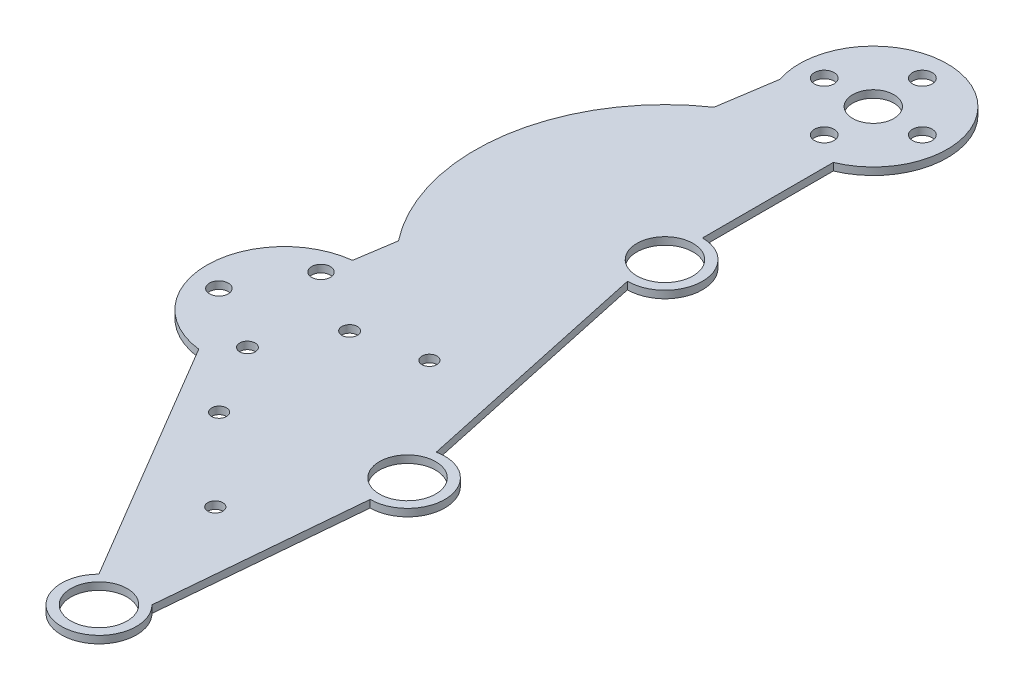
from build123d import *

# Parameters (mm, degrees)
SKETCH1_R           = 1.6
SKETCH1_R_2         = 2
SKETCH1_R_3         = 1.65
SKETCH1_R_4         = 6
BOSS_EXTRUDE2_DEPTH = 1.5875
BOSS_EXTRUDE3_START = -1.5875
BOSS_EXTRUDE3_DEPTH = 1.5875
SKETCH4_R           = 4.4
SKETCH4_R_2         = 2.1
CUT_EXTRUDE1_DEPTH  = 1.5875


with BuildPart() as part:
    # Sketch1 → Boss-Extrude2 (new body)
    with BuildSketch(Plane(origin=(0, 0, 0), x_dir=(1, 0, 0), z_dir=(0, 1, 0))):
        with BuildLine():
            Line((57.785577921, -3.804263015), (46.607089569, 48.169037391))
            ThreePointArc((46.607089569, 48.169037391), (54.607089569, 56.169037391), (46.607089569, 64.169037391))
            Line((46.607089569, 64.169037391), (46.607089569, 96.669037391))
            ThreePointArc((46.607089569, 96.669037391), (9.774896481, 73.010639225), (15.974342375, 29.675928865))
            Line((15.974342375, 29.675928865), (13.412399058, 22.705365919))
            ThreePointArc((13.412399058, 22.705365919), (-1.253243965, 6.307648563), (13.412399058, -10.090068793))
            Line((13.412399058, -10.090068793), (44.33382846, -62.316035804))
            ThreePointArc((44.33382846, -62.316035804), (50, -75.963557391), (55.66617154, -62.316035804))
            Line((55.66617154, -62.316035804), (59.462816555, -19.578912916))
            ThreePointArc((59.462816555, -19.578912916), (67.394599283, -10.759075533), (57.785577921, -3.804263015))
        make_face()
        with Locations(Location((27.233234802, -19.578912916, 0), (0, 0, 270))):
            Circle(SKETCH1_R, mode=Mode.SUBTRACT)
        with Locations(Location((44.33382846, -37.488387538, 0), (0, 0, 270))):
            Circle(SKETCH1_R, mode=Mode.SUBTRACT)
        with Locations(Location((40.089632361, 12.439739227, 0), (0, 0, 270))):
            Circle(SKETCH1_R, mode=Mode.SUBTRACT)
        with Locations(Location((12.19812376, 17.202869591, 0), (0, 0, 270))):
            Circle(SKETCH1_R_2, mode=Mode.SUBTRACT)
        with Locations(Location((26.141977063, 9.356280839, 0), (0, 0, 270))):
            Circle(SKETCH1_R_3, mode=Mode.SUBTRACT)
        with Locations(Location((4.351535007, 3.259016288, 0), (0, 0, 270))):
            Circle(SKETCH1_R_2, mode=Mode.SUBTRACT)
        with Locations(Location((18.295388311, -4.587572465, 0), (0, 0, 270))):
            Circle(SKETCH1_R_3, mode=Mode.SUBTRACT)
        with Locations(Location((46.607089569, 56.169037391, 0), (0, 0, 270))):
            Circle(SKETCH1_R_4, mode=Mode.SUBTRACT)
        with Locations(Location((59.462816555, -11.60242182, 0), (0, 0, 270))):
            Circle(SKETCH1_R_4, mode=Mode.SUBTRACT)
        with Locations(Location((50, -67.963557391, 0), (0, 0, 270))):
            Circle(SKETCH1_R_4, mode=Mode.SUBTRACT)
    extrude(amount=BOSS_EXTRUDE2_DEPTH)

    # Sketch3 → Boss-Extrude3 (add)
    with BuildSketch(Plane(origin=(0, 1.5875, 0), x_dir=(1, 0, 0), z_dir=(0, 1, 0)).offset(BOSS_EXTRUDE3_START)):
        with BuildLine():
            ThreePointArc((56.343437375, 106.672616503), (38.029280092, 122.267991205), (25.551142047, 101.702968958))
            ThreePointArc((25.551142047, 101.702968958), (27.87263843, 97.242332074), (31.478334129, 93.737252132))
            ThreePointArc((31.478334129, 93.737252132), (38.901984022, 95.929336038), (46.607089569, 96.669037391))
            Line((46.607089569, 96.669037391), (46.607089569, 92.08436081))
            ThreePointArc((46.607089569, 92.08436081), (53.685796044, 97.903157102), (56.343437375, 106.672616503))
        make_face()
        with BuildLine():
            ThreePointArc((46.607089569, 96.669037391), (38.901984022, 95.929336038), (31.478334129, 93.737252132))
            ThreePointArc((31.478334129, 93.737252132), (38.83054718, 90.968883646), (46.607089569, 92.08436081))
            Line((46.607089569, 92.08436081), (46.607089569, 96.669037391))
        make_face()
        with BuildLine():
            Line((25.551142047, 101.702968958), (23.684957519, 89.558045497))
            ThreePointArc((23.684957519, 89.558045497), (27.467237121, 91.860997946), (31.478334129, 93.737252132))
            ThreePointArc((31.478334129, 93.737252132), (27.87263843, 97.242332074), (25.551142047, 101.702968958))
        make_face()
        with BuildLine():
            Line((14.718034312, 31.202296417), (13.412399058, 22.705365919))
            Line((13.412399058, 22.705365919), (15.974342375, 29.675928865))
            ThreePointArc((15.974342375, 29.675928865), (15.33687379, 30.431446107), (14.718034312, 31.202296417))
        make_face()
    extrude(amount=BOSS_EXTRUDE3_DEPTH)

    # Sketch4 → Cut-Extrude1 (cut)
    with BuildSketch(Plane(origin=(0, 1.5875, 0), x_dir=(1, 0, 0), z_dir=(0, 1, 0))):
        with Locations(Location((40.546257627, 106.672616503, 0), (0, 0, 270))):
            Circle(SKETCH4_R)
        with Locations(Location((40.546257627, 117.14024961, 0), (0, 0, 270))):
            Circle(SKETCH4_R_2)
        with Locations(Location((30.07862452, 106.672616503, 0), (0, 0, 270))):
            Circle(SKETCH4_R_2)
        with Locations(Location((51.013890734, 106.672616503, 0), (0, 0, 270))):
            Circle(SKETCH4_R_2)
        with Locations(Location((40.546257627, 96.204983396, 0), (0, 0, 270))):
            Circle(SKETCH4_R_2)
    extrude(amount=-CUT_EXTRUDE1_DEPTH, mode=Mode.SUBTRACT)


solid = part.part
